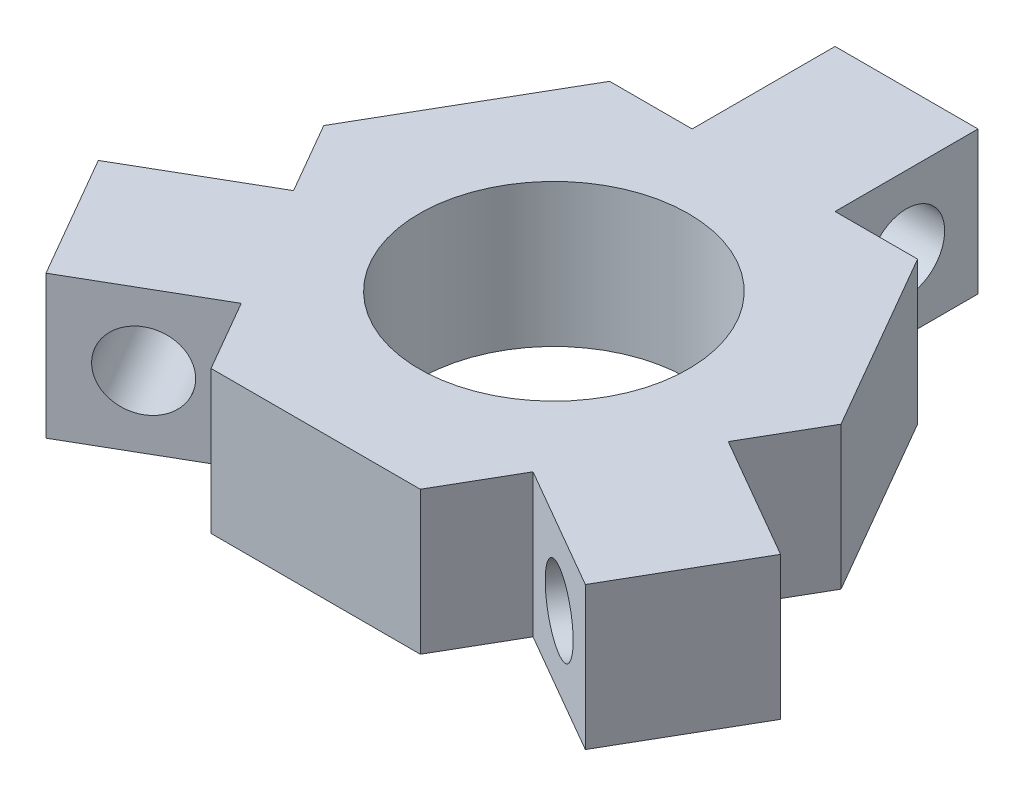
from build123d import *

# Parameters (mm, degrees)
SKETCH_1_W          = 6
SKETCH_1_H          = 6
EXTRUDE_2_DEPTH     = 6
SKETCH_6_R          = 1.6
CUT_EXTRUDE_5_DEPTH = 6
SKETCH_7_R          = 1.6
CUT_EXTRUDE_6_DEPTH = 6
SKETCH_8_R          = 1.6
CUT_EXTRUDE_7_DEPTH = 6
SKETCH_9_R          = 5.65
CUT_EXTRUDE_9_DEPTH = 6


with BuildPart() as part:
    # 草图1 → 凸台-拉伸2 (new body)
    with BuildSketch(Plane(origin=(0, 0, 0), x_dir=(1, 0, 0), z_dir=(0, 1, 0))):
        Polygon((-3, 8.803847577), (-6.464101615, 8.803847577), (-10.856406461, 1.196152423), (-9.124355653, -1.803847577), (-6.124355653, -7), (-4.392304845, -10), (4.392304845, -10), (6.124355653, -7), (9.124355653, -1.803847577), (10.856406461, 1.196152423), (6.464101615, 8.803847577), (3, 8.803847577), align=None)
        Polygon((-9.124355653, -1.803847577), (-14.320508076, -4.803847577), (-11.320508076, -10), (-6.124355653, -7), align=None)
        Polygon((11.320508076, -10), (14.320508076, -4.803847577), (9.124355653, -1.803847577), (6.124355653, -7), align=None)
        with Locations((0, 11.803847577)):
            Rectangle(SKETCH_1_W, SKETCH_1_H)
    extrude(amount=EXTRUDE_2_DEPTH)

    # 草图6 → 切除-拉伸5 (cut)
    with BuildSketch(Plane(origin=(-1.5, 0, -2.598076211), x_dir=(-0.8660254037844386, 0, 0.5000000000000001), z_dir=(-0.5000000000000001, 0, -0.8660254037844386))):
        with Locations((11.803847577, 3)):
            Circle(SKETCH_6_R)
    extrude(amount=-CUT_EXTRUDE_5_DEPTH, mode=Mode.SUBTRACT)

    # 草图7 → 切除-拉伸6 (cut)
    with BuildSketch(Plane(origin=(3, 0, 0), x_dir=(0, 0, -1), z_dir=(1, 0, 0))):
        with Locations((11.803847577, 3)):
            Circle(SKETCH_7_R)
    extrude(amount=-CUT_EXTRUDE_6_DEPTH, mode=Mode.SUBTRACT)

    # 草图8 → 切除-拉伸7 (cut)
    with BuildSketch(Plane(origin=(-1.5, 0, 2.598076211), x_dir=(0.8660254037844387, 0, 0.49999999999999983), z_dir=(-0.49999999999999983, 0, 0.8660254037844387))):
        with Locations((11.803847577, 3)):
            Circle(SKETCH_8_R)
    extrude(amount=-CUT_EXTRUDE_7_DEPTH, mode=Mode.SUBTRACT)

    # 草图9 → 切除-拉伸9 (cut)
    with BuildSketch(Plane.XZ):
        with Locations(Location((0, 0, 0), (0, 0, 270))):
            Circle(SKETCH_9_R)
    extrude(amount=-CUT_EXTRUDE_9_DEPTH, mode=Mode.SUBTRACT)


solid = part.part
